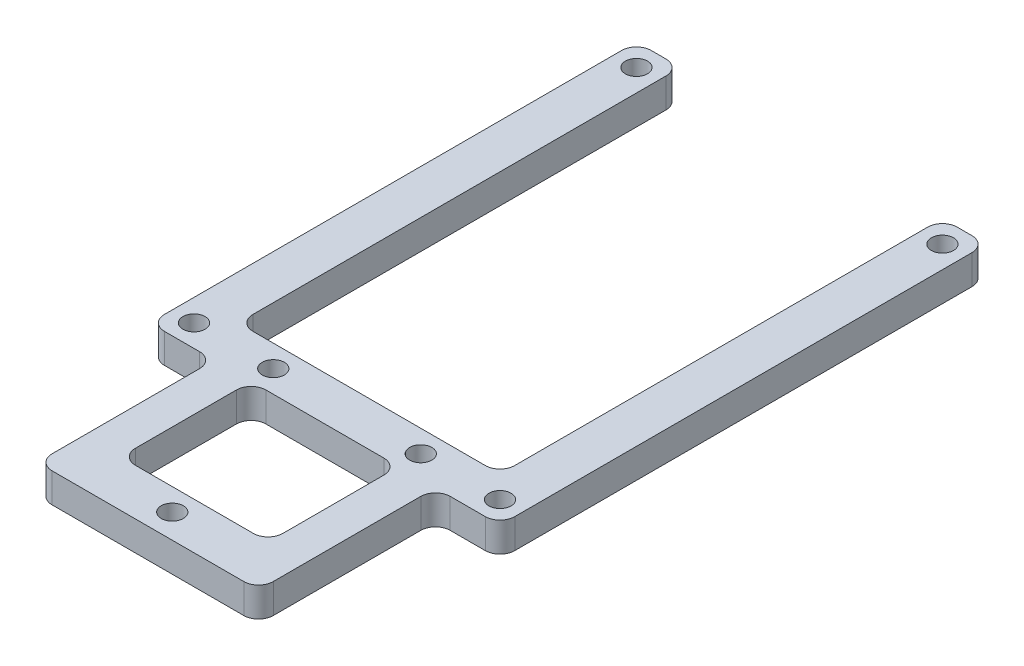
from build123d import *

# Parameters (mm, degrees)
SKETCH_1_W          = 47.5
SKETCH_1_H          = 90
SKETCH_1_R          = 1.5
EXTRUDE_1_DEPTH     = 4
SKETCH_2_R          = 1.5
SKETCH_2_W          = 35.5
SKETCH_2_H          = 60
SKETCH_2_W_2        = 8.75
SKETCH_2_H_2        = 24
SKETCH_2_W_3        = 20
SKETCH_2_H_3        = 17.7
CUT_EXTRUDE_2_DEPTH = 94.166853011
FILLET_1_R          = 2


with BuildPart() as part:
    # 草图1 → 凸台-拉伸1 (new body)
    with BuildSketch(Plane(origin=(0, 0, 0), x_dir=(1, 0, 0), z_dir=(0, 1, 0))):
        with Locations((0, 45)):
            Rectangle(SKETCH_1_W, SKETCH_1_H)
        with Locations(Location((-10, 27, 0), (0, 0, 270))):
            Circle(SKETCH_1_R, mode=Mode.SUBTRACT)
        with Locations(Location((0, 3.3, 0), (0, 0, 270))):
            Circle(SKETCH_1_R, mode=Mode.SUBTRACT)
        with Locations(Location((10, 27, 0), (0, 0, 90))):
            Circle(SKETCH_1_R, mode=Mode.SUBTRACT)
    extrude(amount=EXTRUDE_1_DEPTH)

    # 草图2 → 切除-拉伸2 (cut, through all)
    with BuildSketch(Plane(origin=(0, 0, 0), x_dir=(1, 0, 0), z_dir=(0, 1, 0))):
        with Locations(Location((-20.75, 87, 0), (0, 0, 270))):
            Circle(SKETCH_2_R)
        with Locations(Location((20.75, 87, 0), (0, 0, 90))):
            Circle(SKETCH_2_R)
        with Locations(Location((-20.75, 27, 0), (0, 0, 270))):
            Circle(SKETCH_2_R)
        with Locations(Location((20.75, 27, 0), (0, 0, 90))):
            Circle(SKETCH_2_R)
        with Locations((0, 60)):
            Rectangle(SKETCH_2_W, SKETCH_2_H)
        with Locations((-19.375, 12)):
            Rectangle(SKETCH_2_W_2, SKETCH_2_H_2)
        with Locations((19.375, 12)):
            Rectangle(SKETCH_2_W_2, SKETCH_2_H_2)
        with Locations((0, 15.15)):
            Rectangle(SKETCH_2_W_3, SKETCH_2_H_3)
    extrude(amount=CUT_EXTRUDE_2_DEPTH, mode=Mode.SUBTRACT)

    # 圆角1
    fillet_1_edges = [part.edges().sort_by_distance(p)[0] for p in [
        (-23.75, 2, -24),
        (-15, 2, 0),
        (-15, 2, -24),
        (-10, 2, -24),
        (-10, 2, -6.3),
        (10, 2, -6.3),
        (10, 2, -24),
        (23.75, 2, -24),
        (15, 2, -24),
        (15, 2, 0),
        (-17.75, 2, -90),
        (-17.75, 2, -30),
        (17.75, 2, -30),
        (17.75, 2, -90),
        (-23.75, 2, -90),
        (23.75, 2, -90),
    ]]
    fillet(fillet_1_edges, radius=FILLET_1_R)


solid = part.part
